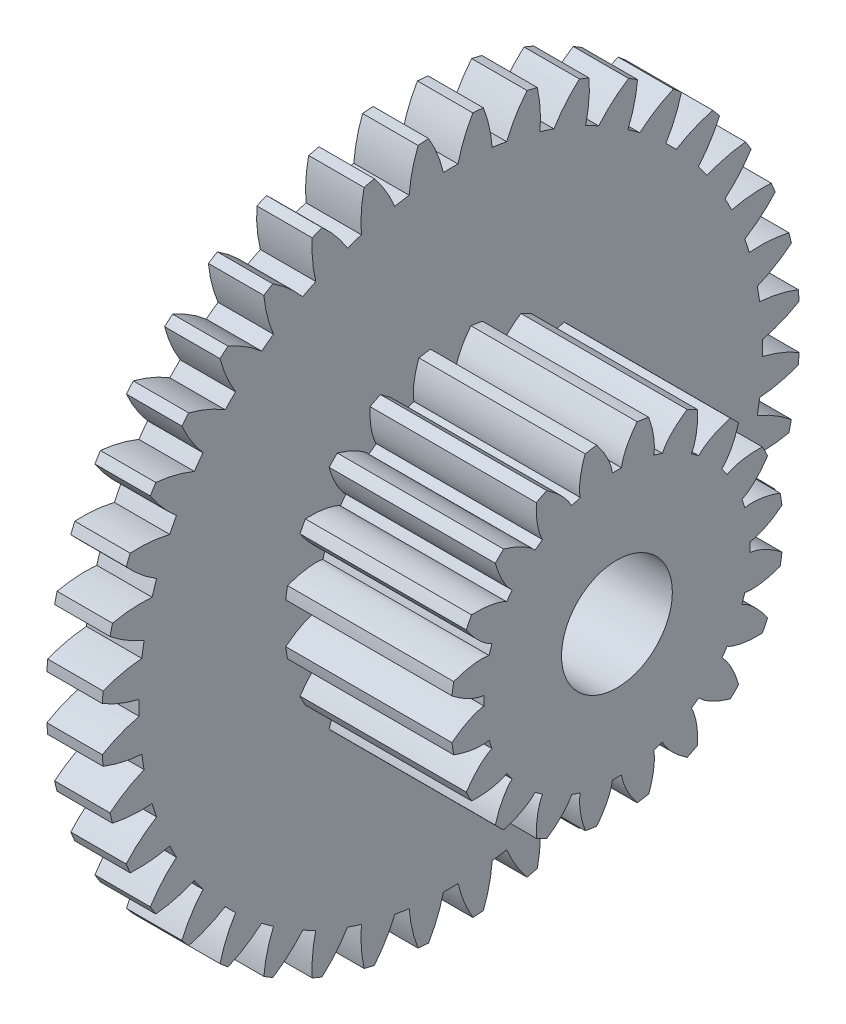
from build123d import *

# Parameters (mm, degrees)
BASPROSKE_W                  = 1
BASPROSKE_H                  = 6.3
TOOTHCUT_DEPTH               = 9.96548939
TEETHCUTS_COUNT              = 40
TEETHCUTS_ANGLE              = 351
BORSKE_R                     = 1
BORE_DEPTH                   = 50.0000508
ESTRUSIONE_ESTRUSIONE1_START = 3
SCHIZZO1_R                   = 3
SCHIZZO1_R_2                 = 1
ESTRUSIONE_ESTRUSIONE1_DEPTH = 3
TAGLIO_ESTRUSIONE1_DEPTH     = 3
RIPETIZIONECIRCOLARE1_COUNT  = 20


with BuildPart() as part:
    # BasProSke → Base-Revolve (revolve)
    with BuildSketch(Plane(origin=(0, 0, 0), x_dir=(1, 0, 0), z_dir=(0, 1, 0)), mode=Mode.PRIVATE) as base_revolve_sk:
        with Locations((0.5, 3.15)):
            Rectangle(BASPROSKE_W, BASPROSKE_H)
    revolve(base_revolve_sk.sketch.rotate(Axis((-10, 0, 0), (1, 0, 0)), 180), axis=Axis((-10, 0, 0), (1, 0, 0)))

    # TooCutSke → ToothCut (cut, through all)
    with BuildSketch(Plane(origin=(0, 0, 0), x_dir=(0, 0, -1), z_dir=(1, 0, 0))):
        with BuildLine():
            ThreePointArc((0.132139403, 5.622447437), (0, 5.624), (-0.132139403, 5.622447437))
            ThreePointArc((-0.132139403, 5.622447437), (-0.246228658, 5.978143985), (-0.414130153, 6.311828687))
            ThreePointArc((-0.414130153, 6.311828687), (0, 6.3254), (0.414130153, 6.311828687))
            ThreePointArc((0.414130153, 6.311828687), (0.246228658, 5.978143985), (0.132139403, 5.622447437))
        make_face()
    toothcut = extrude(amount=TOOTHCUT_DEPTH, mode=Mode.SUBTRACT)

    # TeethCuts: ToothCut ×40 about axis
    teethcuts_axis = Axis((-10, 0, 0), (1, 0, 0))
    for i in range(1, TEETHCUTS_COUNT):
        add(toothcut.rotate(teethcuts_axis, i * TEETHCUTS_ANGLE / (TEETHCUTS_COUNT - 1)), mode=Mode.SUBTRACT)

    # BorSke → Bore (cut, symmetric)
    with BuildSketch(Plane(origin=(0, 0, 0), x_dir=(0, 0, -1), z_dir=(1, 0, 0))):
        with Locations(Location((0, 0, 0), (0, 0, 180))):
            Circle(BORSKE_R)
    extrude(amount=BORE_DEPTH, both=True, mode=Mode.SUBTRACT)

    # Schizzo1 → Estrusione-Estrusione1 (add)
    with BuildSketch(Plane(origin=(1, 0, 0), x_dir=(0, 0, -1), z_dir=(1, 0, 0)).offset(ESTRUSIONE_ESTRUSIONE1_START)):
        with Locations(Location((0, 0, 0), (0, 0, 180))):
            Circle(SCHIZZO1_R)
        Circle(SCHIZZO1_R_2, mode=Mode.SUBTRACT)
    extrude(amount=-ESTRUSIONE_ESTRUSIONE1_DEPTH)

    # Schizzo2 → Taglio-Estrusione1 (cut)
    with BuildSketch(Plane(origin=(4, 0, 0), x_dir=(0, 0, -1), z_dir=(1, 0, 0))):
        with BuildLine():
            Line((3.606041595, -1.126517228), (3.606041595, 1.126517228))
            add(Edge.make_bspline(
                [(2.398537985, 0.083758792), (2.40096931, 0.083843696), (2.407780495, 0.084248524), (2.420617047, 0.085671661), (2.441453983, 0.088923729), (2.479880434, 0.096949355), (2.525362215, 0.109831941), (2.575901253, 0.127537111), (2.629237375, 0.149669417), (2.674164848, 0.170495515), (2.718294398, 0.193014596), (2.761595314, 0.217004426), (2.813206122, 0.247869607), (2.873882866, 0.287373106), (2.942882946, 0.337077063), (3.018747257, 0.397543673), (3.093292797, 0.463379186), (3.164295131, 0.531572957), (3.233137223, 0.604212864), (3.297675419, 0.677138097), (3.361514842, 0.756479087), (3.418830039, 0.831567549), (3.479307016, 0.919433258), (3.527036703, 0.99145794), (3.573101215, 1.068809216), (3.595037086, 1.10688298), (3.606041595, 1.126517228)],
                knots=[0, 0, 0, 0, 0, 0.005376748, 0.015083688, 0.02853182, 0.046610139, 0.092110525, 0.119476175, 0.146842495, 0.174208853, 0.201574955, 0.228941013, 0.256307345, 0.307035032, 0.361767351, 0.41649966, 0.471231936, 0.525964281, 0.580696615, 0.635428982, 0.690161387, 0.744893688, 0.799626083, 0.854358409, 0.909090916, 0.909090916, 0.909090916, 0.909090916, 0.909090916], degree=4))
            ThreePointArc((2.398537985, 0.083758792), (2.4, 0), (2.398537985, -0.083758792))
            add(Edge.make_bspline(
                [(2.398537985, -0.083758792), (2.40096931, -0.083843696), (2.407780495, -0.084248524), (2.420617047, -0.085671661), (2.441453983, -0.088923729), (2.479880434, -0.096949355), (2.525362215, -0.109831941), (2.575901253, -0.127537111), (2.629237375, -0.149669417), (2.674164848, -0.170495515), (2.718294398, -0.193014596), (2.761595314, -0.217004426), (2.813206122, -0.247869607), (2.873882866, -0.287373106), (2.942882946, -0.337077063), (3.018747257, -0.397543673), (3.093292797, -0.463379186), (3.164295131, -0.531572957), (3.233137223, -0.604212864), (3.297675419, -0.677138097), (3.361514842, -0.756479087), (3.418830039, -0.831567549), (3.479307016, -0.919433258), (3.527036703, -0.99145794), (3.573101215, -1.068809216), (3.595037086, -1.10688298), (3.606041595, -1.126517228)],
                knots=[0, 0, 0, 0, 0, 0.005376748, 0.015083688, 0.02853182, 0.046610139, 0.092110525, 0.119476175, 0.146842495, 0.174208853, 0.201574955, 0.228941013, 0.256307345, 0.307035032, 0.361767351, 0.41649966, 0.471231936, 0.525964281, 0.580696615, 0.635428982, 0.690161387, 0.744893688, 0.799626083, 0.854358409, 0.909090916, 0.909090916, 0.909090916, 0.909090916, 0.909090916], degree=4))
        make_face()
    taglio_estrusione1 = extrude(amount=-TAGLIO_ESTRUSIONE1_DEPTH, mode=Mode.SUBTRACT)

    # RipetizioneCircolare1: Taglio-Estrusione1 ×20 about axis
    ripetizionecircolare1_axis = Axis((4, 0, 0), (1, 0, 0))
    for i in range(1, RIPETIZIONECIRCOLARE1_COUNT):
        add(taglio_estrusione1.rotate(ripetizionecircolare1_axis, i * 360 / RIPETIZIONECIRCOLARE1_COUNT), mode=Mode.SUBTRACT)


solid = part.part
